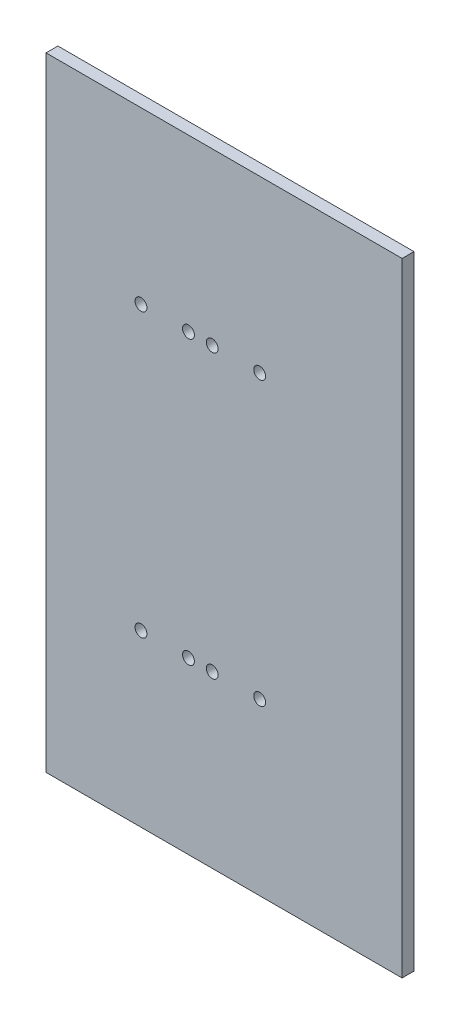
from build123d import *

# Parameters (mm, degrees)
SKETCH_1_W      = 60
SKETCH_1_H      = 105
SKETCH_1_R      = 1
EXTRUDE_1_DEPTH = 2


with BuildPart() as part:
    # 草圖1 → 填料-伸長1 (new body)
    with BuildSketch(Plane.XY):
        with Locations((-6.971831956, -9.487447699)):
            Rectangle(SKETCH_1_W, SKETCH_1_H)
        with Locations((-12.971831956, -33.287447699)):
            Circle(SKETCH_1_R, mode=Mode.SUBTRACT)
        with Locations((-8.971831956, -33.287447699)):
            Circle(SKETCH_1_R, mode=Mode.SUBTRACT)
        with Locations((-12.971831956, 14.312552301)):
            Circle(SKETCH_1_R, mode=Mode.SUBTRACT)
        with Locations((-20.971831956, 14.312552301)):
            Circle(SKETCH_1_R, mode=Mode.SUBTRACT)
        with Locations((-0.971831956, 14.312552301)):
            Circle(SKETCH_1_R, mode=Mode.SUBTRACT)
        with Locations((-8.971831956, 14.312552301)):
            Circle(SKETCH_1_R, mode=Mode.SUBTRACT)
        with Locations((-20.971831956, -33.287447699)):
            Circle(SKETCH_1_R, mode=Mode.SUBTRACT)
        with Locations((-0.971831956, -33.287447699)):
            Circle(SKETCH_1_R, mode=Mode.SUBTRACT)
    extrude(amount=EXTRUDE_1_DEPTH)


solid = part.part
